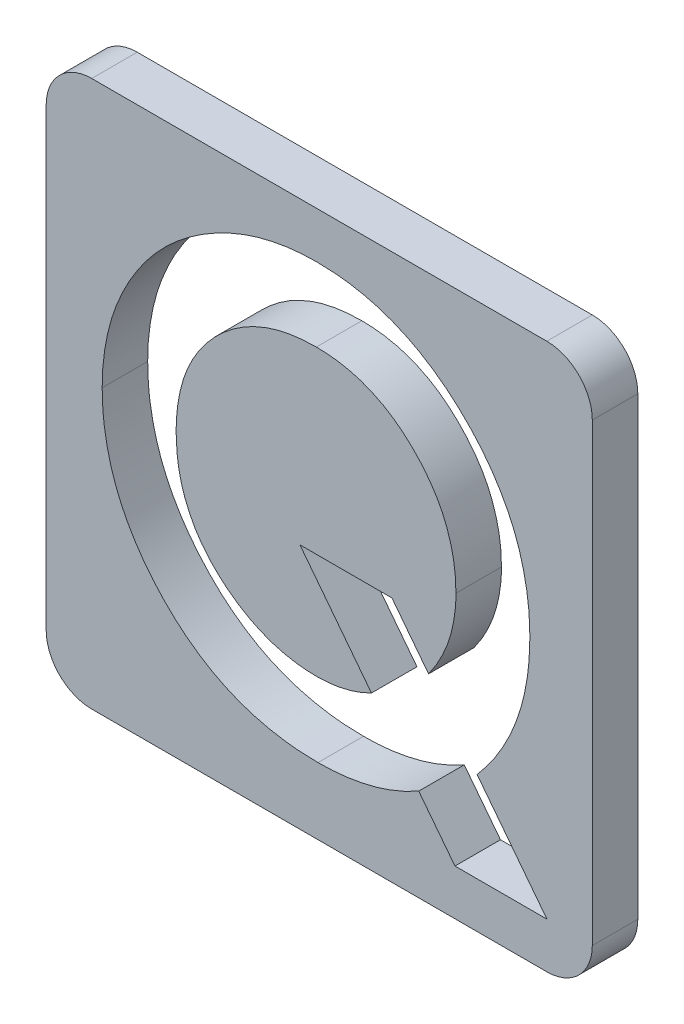
from build123d import *

# Parameters (mm, degrees)
BOSS_EXTRUDE1_DEPTH = 10
CUT_EXTRUDE30_DEPTH = 10


with BuildPart() as part:
    # Sketch1 → Boss-Extrude1 (new body)
    with BuildSketch(Plane.XY):
        with BuildLine():
            Line((-50, 60), (50, 60))
            ThreePointArc((50, 60), (57.071067812, 57.071067812), (60, 50))
            Line((60, 50), (60, -50))
            ThreePointArc((60, -50), (57.071067812, -57.071067812), (50, -60))
            Line((50, -60), (-50, -60))
            ThreePointArc((-50, -60), (-57.071067812, -57.071067812), (-60, -50))
            Line((-60, -50), (-60, 50))
            ThreePointArc((-60, 50), (-57.071067812, 57.071067812), (-50, 60))
        make_face()
    extrude(amount=BOSS_EXTRUDE1_DEPTH)

    # Sketch2 → Cut-Extrude30 (cut)
    with BuildSketch(Plane.XY.offset(10)):
        with BuildLine():
            Line((34.679487179, -30.110276442), (50.034755609, -49.961538462))
            Line((50.034755609, -49.961538462), (29.820913462, -49.961538462))
            Line((29.820913462, -49.961538462), (21.862279647, -39.682391827))
            add(Edge.make_bspline(
                [(21.862279647, -39.682391827), (21.028636889, -40.13631813), (19.365283671, -41.042029562), (16.756926427, -42.17144448), (14.100283795, -43.162249693), (11.356860263, -43.938644226), (8.552995064, -44.549760982), (5.674160188, -45.016358639), (2.722415565, -45.262385211), (0.730299256, -45.301040212), (-0.273237179, -45.320512821)],
                knots=[0, 0, 0, 0, 0.985706899, 1.966764212, 2.949968678, 3.929638882, 4.925906056, 5.930211904, 6.957336097, 8, 8, 8, 8], degree=3))
            add(Edge.make_bspline(
                [(-0.273237179, -45.320512821), (-1.943707755, -45.2830191), (-5.220125373, -45.20947989), (-10.018525485, -44.503359304), (-14.612024859, -43.437309106), (-18.983572708, -41.879755235), (-23.147896164, -39.900451393), (-27.071705006, -37.44757751), (-30.800639809, -34.589140476), (-34.243467737, -31.297087019), (-37.393601579, -27.729534621), (-40.146065424, -23.939279645), (-42.485840439, -19.985458154), (-44.393993134, -15.861867917), (-45.877775794, -11.561399926), (-46.916857054, -7.095800135), (-47.575617941, -2.458897103), (-47.657273074, 0.688675998), (-47.698717949, 2.286258013)],
                knots=[0, 0, 0, 0, 1.070144486, 2.098953612, 3.10240755, 4.088674545, 5.067611437, 6.052256776, 7.0494179, 8.074208254, 9.100739571, 10.09639475, 11.072322686, 12.041159829, 13.004031207, 13.983083054, 14.976293755, 16, 16, 16, 16], degree=3))
            add(Edge.make_bspline(
                [(-47.698717949, 2.286258013), (-47.68490183, 3.356733224), (-47.657444538, 5.484128975), (-47.327210884, 8.6368946), (-46.850752443, 11.727833839), (-46.151190307, 14.74033241), (-45.288582206, 17.696491246), (-44.191031683, 20.572805967), (-42.919073323, 23.396589439), (-41.459855526, 26.144382866), (-39.802380811, 28.775558698), (-38.041061641, 31.31102389), (-36.081873052, 33.669369844), (-33.994159324, 35.903707249), (-31.77106306, 38.012572637), (-29.377573837, 39.952497747), (-26.859174583, 41.771624572), (-24.197719737, 43.43181558), (-21.439412994, 44.93246709), (-18.609641292, 46.236635032), (-15.729942798, 47.352337727), (-12.799243113, 48.261207723), (-9.808627646, 48.942314164), (-6.784411427, 49.460902683), (-3.699171778, 49.749373328), (-1.627421569, 49.796645772), (-0.581430288, 49.820512821)],
                knots=[0, 0, 0, 0, 1.035855852, 2.058595393, 3.065553363, 4.06176554, 5.050183643, 6.044349766, 7.039272903, 8.046842428, 9.053256483, 10.04817962, 11.033146707, 12.018200652, 13.007259073, 13.996749908, 14.99846043, 16.012935138, 17.03119782, 18.036301871, 19.027088812, 20.018894167, 21.003704893, 21.994284571, 22.987348552, 24, 24, 24, 24], degree=3))
            add(Edge.make_bspline(
                [(-0.581430288, 49.820512821), (0.998184613, 49.780346116), (4.110818488, 49.701197556), (8.68948271, 49.024406152), (13.104883273, 47.946293747), (17.338813358, 46.388632552), (21.41715076, 44.424629811), (25.299249447, 41.994489959), (29.026189183, 39.148326151), (32.517455101, 35.884771616), (35.743898736, 32.343029059), (38.55659627, 28.543134016), (40.937713959, 24.557638894), (42.923461145, 20.384954757), (44.419502424, 16.000695357), (45.487496376, 11.433969418), (46.163505462, 6.681564069), (46.242105962, 3.442758404), (46.282051282, 1.79677484)],
                knots=[0, 0, 0, 0, 1.015551519, 2.00114601, 2.970254478, 3.93428303, 4.897362978, 5.876714212, 6.874912676, 7.909046156, 8.946527051, 9.952474942, 10.9443724, 11.928494229, 12.919233427, 13.917651329, 14.941735923, 16, 16, 16, 16], degree=3))
            add(Edge.make_bspline(
                [(46.282051282, 1.79677484), (46.248842407, 0.278228079), (46.183527095, -2.708454096), (45.617682253, -7.111443251), (44.72453868, -11.355335032), (43.441766637, -15.443145433), (41.816142299, -19.370418849), (39.790609499, -23.125463581), (37.454914599, -26.752859668), (35.609241868, -28.98555815), (34.679487179, -30.110276442)],
                knots=[0, 0, 0, 0, 1.049646143, 2.064447078, 3.064298101, 4.044929938, 5.022708814, 5.998521441, 6.991758374, 8, 8, 8, 8], degree=3))
        make_face()
        with BuildLine():
            add(Edge.make_bspline(
                [(24.01963141, -16.295973558), (24.503152044, -15.602754628), (25.459053382, -14.232287977), (26.668577179, -12.058541493), (27.707571786, -9.842440449), (28.566779655, -7.572356125), (29.220378102, -5.235279024), (29.684941119, -2.846466341), (29.992583116, -0.404824089), (30.023088765, 1.239887216), (30.038461538, 2.068709936)],
                knots=[0, 0, 0, 0, 1.031533623, 2.039301536, 3.033003023, 4.018477747, 4.999688364, 5.992485227, 6.988348989, 8, 8, 8, 8], degree=3))
            add(Edge.make_bspline(
                [(30.038461538, 2.068709936), (30.009850326, 3.145674355), (29.953533519, 5.265514566), (29.530549262, 8.381710893), (28.821940832, 11.368152518), (27.833892691, 14.23214909), (26.589602509, 16.981052453), (25.026511142, 19.591973208), (23.190084094, 22.078472075), (21.098048857, 24.416603027), (18.820371693, 26.55651043), (16.398006708, 28.44114004), (13.847570492, 30.031089832), (11.167571056, 31.314870476), (8.387079976, 32.348864672), (5.476258352, 33.042886895), (2.460477205, 33.49793493), (0.405269645, 33.550364386), (-0.635817308, 33.576923077)],
                knots=[0, 0, 0, 0, 1.056263418, 2.079093448, 3.078410197, 4.062632158, 5.04680056, 6.032966551, 7.041959893, 8.074807684, 9.106532056, 10.103754224, 11.080880922, 12.048629763, 13.014470275, 13.984975, 14.979267944, 16, 16, 16, 16], degree=3))
            add(Edge.make_bspline(
                [(-0.635817308, 33.576923077), (-1.706882135, 33.548900581), (-3.814966885, 33.493746315), (-6.909817152, 33.062604664), (-9.878432223, 32.386342916), (-12.705207788, 31.393419492), (-15.398702815, 30.142314304), (-17.958793751, 28.607183918), (-20.37265042, 26.779432419), (-22.646011859, 24.712596214), (-24.70007342, 22.419154278), (-26.51393123, 19.959815561), (-28.032083163, 17.340510368), (-29.303479816, 14.585091262), (-30.26057587, 11.662702458), (-30.942282438, 8.596200892), (-31.373096623, 5.380312305), (-31.4274012, 3.188044879), (-31.455128205, 2.068709936)],
                knots=[0, 0, 0, 0, 1.042613217, 2.052085894, 3.036973397, 4.002832266, 4.963730975, 5.924467509, 6.903642813, 7.907474205, 8.911719447, 9.896835452, 10.877830278, 11.85475743, 12.846581833, 13.865885605, 14.910357018, 16, 16, 16, 16], degree=3))
            add(Edge.make_bspline(
                [(-31.455128205, 2.068709936), (-31.418374502, 0.828229349), (-31.346343335, -1.602907063), (-30.839297587, -5.149286692), (-29.97239753, -8.498855058), (-28.718537237, -11.633528512), (-27.169103125, -14.597442255), (-25.217080975, -17.327470301), (-22.947238015, -19.877591592), (-21.195083665, -21.361988659), (-20.305789263, -22.115384615)],
                knots=[0, 0, 0, 0, 1.078047314, 2.112794111, 3.106520711, 4.077995885, 5.041371964, 6.006121678, 6.988020189, 8, 8, 8, 8], degree=3))
            add(Edge.make_bspline(
                [(-20.305789263, -22.115384615), (-19.578177215, -22.673089048), (-18.135261117, -23.779064006), (-15.823836417, -25.17900528), (-13.454762015, -26.395140491), (-11.005637064, -27.367427381), (-8.484922157, -28.140683352), (-5.893153297, -28.676320773), (-3.225267882, -29.017276933), (-1.422453394, -29.056863433), (-0.508914263, -29.076923077)],
                knots=[0, 0, 0, 0, 1.027457745, 2.037535419, 3.025615023, 4.011018129, 4.9886297, 5.978868484, 6.975833209, 8, 8, 8, 8], degree=3))
            add(Edge.make_bspline(
                [(-0.508914263, -29.076923077), (0.539227598, -29.043549083), (2.619596288, -28.977307848), (5.681714216, -28.4002877), (8.665210605, -27.537340864), (10.53562665, -26.655248376), (11.474358974, -26.212540064)],
                knots=[0, 0, 0, 0, 1.010952568, 2.006554787, 2.999521277, 4, 4, 4, 4], degree=3))
            Line((11.474358974, -26.212540064), (-4.243489583, -5.871794872))
            Line((-4.243489583, -5.871794872), (15.970352564, -5.871794872))
            Line((15.970352564, -5.871794872), (24.01963141, -16.295973558))
        make_face(mode=Mode.SUBTRACT)
    extrude(amount=-CUT_EXTRUDE30_DEPTH, mode=Mode.SUBTRACT)


with BuildPart() as cut_extrude30_piece_1:
    # of the separate pieces the step leaves, piece 1, a body of its own (cut_extrude30_pieces)
    add(part.part.solids().sort_by_distance((-50, 60, 0))[0])


with BuildPart() as cut_extrude30_piece_2:
    # of the separate pieces the step leaves, piece 2, a body of its own (cut_extrude30_pieces)
    add(part.part.solids().sort_by_distance((24.01963141, -16.295973558, 0))[0])


solid = Compound([cut_extrude30_piece_1.part, cut_extrude30_piece_2.part])
